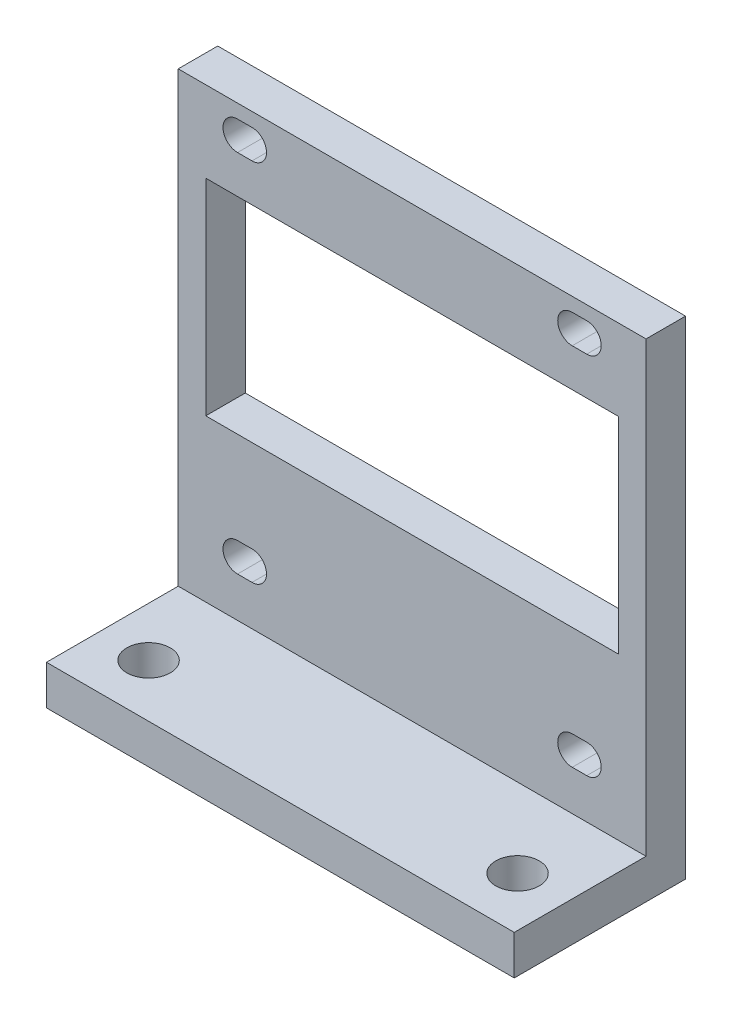
from build123d import *

# Parameters (mm, degrees)
SKETCH1_W           = 35.5
SKETCH1_H           = 37
SKETCH1_W_2         = 31.32
SKETCH1_H_2         = 15.62
BOSS_EXTRUDE1_DEPTH = 3
SKETCH2_W           = 35.5
SKETCH2_H           = 10
SKETCH2_R           = 1.65
BOSS_EXTRUDE2_DEPTH = 3


with BuildPart() as part:
    # Sketch1 → Boss-Extrude1 (new body)
    with BuildSketch(Plane.XY):
        with Locations((17.75, 18.5)):
            Rectangle(SKETCH1_W, SKETCH1_H)
        with BuildLine():
            Line((4.5, 35.95), (5.6, 35.95))
            ThreePointArc((5.6, 35.95), (6.7, 34.85), (5.6, 33.75))
            Line((5.6, 33.75), (4.5, 33.75))
            ThreePointArc((4.5, 33.75), (3.4, 34.85), (4.5, 35.95))
        make_face(mode=Mode.SUBTRACT)
        with BuildLine():
            Line((29.9, 35.95), (31, 35.95))
            ThreePointArc((31, 35.95), (32.1, 34.85), (31, 33.75))
            Line((31, 33.75), (29.9, 33.75))
            ThreePointArc((29.9, 33.75), (28.8, 34.85), (29.9, 35.95))
        make_face(mode=Mode.SUBTRACT)
        with BuildLine():
            Line((29.9, 8.25), (31, 8.25))
            ThreePointArc((31, 8.25), (32.1, 7.15), (31, 6.05))
            Line((31, 6.05), (29.9, 6.05))
            ThreePointArc((29.9, 6.05), (28.8, 7.15), (29.9, 8.25))
        make_face(mode=Mode.SUBTRACT)
        with BuildLine():
            Line((4.5, 8.25), (5.6, 8.25))
            ThreePointArc((5.6, 8.25), (6.7, 7.15), (5.6, 6.05))
            Line((5.6, 6.05), (4.5, 6.05))
            ThreePointArc((4.5, 6.05), (3.4, 7.15), (4.5, 8.25))
        make_face(mode=Mode.SUBTRACT)
        with Locations((17.75, 23.05)):
            Rectangle(SKETCH1_W_2, SKETCH1_H_2, mode=Mode.SUBTRACT)
    extrude(amount=BOSS_EXTRUDE1_DEPTH)

    # Sketch2 → Boss-Extrude2 (add)
    with BuildSketch(Plane.XZ):
        with Locations((17.75, 8)):
            Rectangle(SKETCH2_W, SKETCH2_H)
        with Locations(Location((3.75, 9, 0), (0, 0, 270))):
            Circle(SKETCH2_R, mode=Mode.SUBTRACT)
        with Locations(Location((31.75, 9, 0), (0, 0, 270))):
            Circle(SKETCH2_R, mode=Mode.SUBTRACT)
    extrude(amount=-BOSS_EXTRUDE2_DEPTH)


solid = part.part
